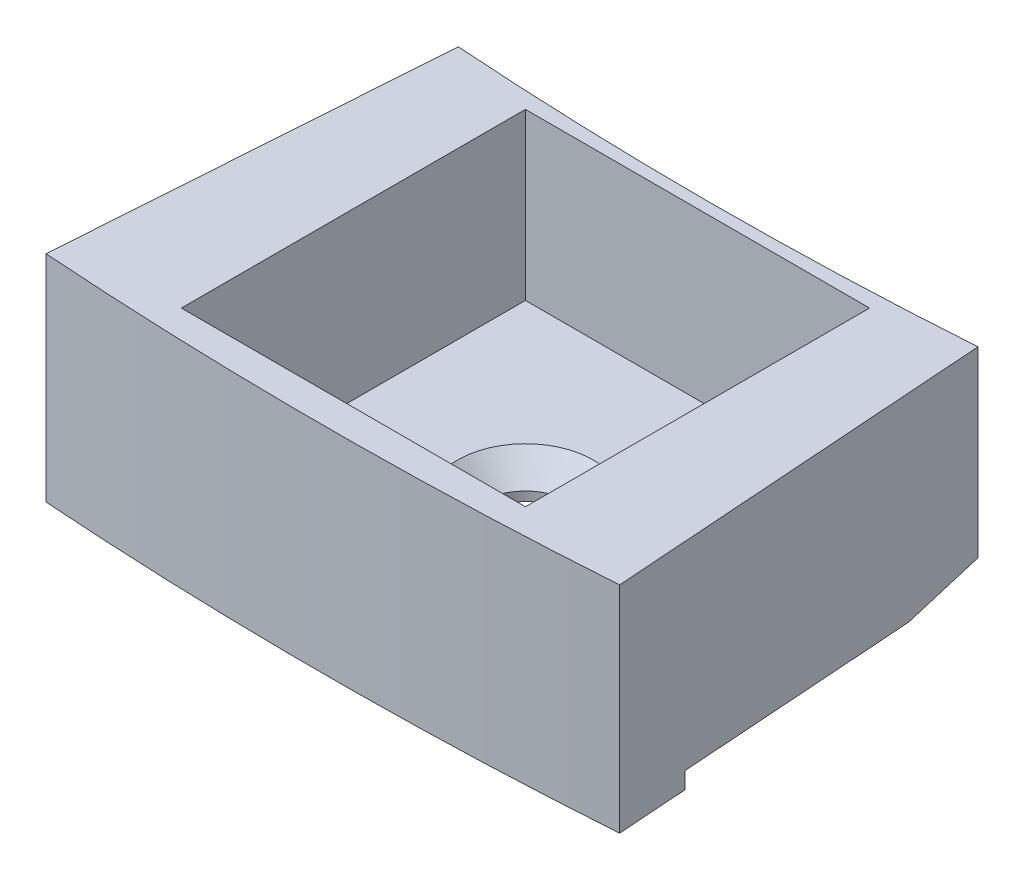
from build123d import *

# Parameters (mm, degrees)
SKETCH2_R           = 2.65
BOSS_EXTRUDE1_DEPTH = 2
BOSS_EXTRUDE2_DEPTH = 2
CHAMFER1_SIZE       = 4.5
CHAMFER1_SIZE2      = 0.956504528
BOSS_EXTRUDE3_START = 1
BOSS_EXTRUDE3_DEPTH = 1
SKETCH21_W          = 20.8
SKETCH21_H          = 20.8
BOSS_EXTRUDE4_DEPTH = 10


with BuildPart() as part:
    # Sketch2 → Boss-Extrude1 (new body)
    with BuildSketch(Plane(origin=(0, 0, 0), x_dir=(1, 0, 0), z_dir=(0, 1, 0))):
        with BuildLine():
            Line((-15.984695958, -228.591802117), (-17.334483725, -247.89466649))
            ThreePointArc((-17.334483725, -247.89466649), (0, -248.5), (17.334483725, -247.89466649))
            Line((17.334483725, -247.89466649), (15.984695958, -228.591802117))
            ThreePointArc((15.984695958, -228.591802117), (0, -229.15), (-15.984695958, -228.591802117))
        make_face()
        with Locations(Location((0, -236.25, 0), (0, 0, 270))):
            Circle(SKETCH2_R, mode=Mode.SUBTRACT)
    extrude(amount=BOSS_EXTRUDE1_DEPTH)

    # Sketch3 → Boss-Extrude2 (add)
    with BuildSketch(Plane(origin=(0, 0, 0), x_dir=(1, 0, 0), z_dir=(0, 1, 0))):
        with BuildLine():
            Line((-15.705670063, -224.601545916), (-15.984695958, -228.591802117))
            ThreePointArc((-15.984695958, -228.591802117), (0, -229.15), (15.984695958, -228.591802117))
            Line((15.984695958, -228.591802117), (15.705670063, -224.601545916))
            ThreePointArc((15.705670063, -224.601545916), (0, -225.15), (-15.705670063, -224.601545916))
        make_face()
    extrude(amount=BOSS_EXTRUDE2_DEPTH)

    # Chamfer1
    chamfer1_edges = [part.edges().sort_by_distance(p)[0] for p in [
        (0, 0, 225.15),
    ]]
    chamfer1_side = [part.faces().sort_by_distance(p)[0] for p in [
        (16.100023839, 0, 236.277479174),
    ]]
    chamfer(chamfer1_edges, length=CHAMFER1_SIZE, length2=CHAMFER1_SIZE2, reference=chamfer1_side[0])

    # Sketch4 → Boss-Extrude3 (add)
    with BuildSketch(Plane.XZ.offset(BOSS_EXTRUDE3_START)):
        with BuildLine():
            Line((-17.334483725, 247.89466649), (-17.038018712, 243.655019276))
            ThreePointArc((-17.038018712, 243.655019276), (0, 244.25), (17.038018712, 243.655019276))
            Line((17.038018712, 243.655019276), (17.334483725, 247.89466649))
            ThreePointArc((17.334483725, 247.89466649), (0, 248.5), (-17.334483725, 247.89466649))
        make_face()
    extrude(amount=-BOSS_EXTRUDE3_DEPTH)

    # Sketch20 → CSK for M3.5 Flat Head Machine Screw2 (revolve, cut)
    with BuildSketch(Plane(origin=(0, 2, 236.25), x_dir=(0, 0, 1), z_dir=(1, 0, 0))):
        Polygon((0, 0), (0, 3), (1.85, 3), (1.85, 2.25), (4.1, 0), align=None)
    revolve(axis=Axis((0, 8.35, 236.25), (0, -1, 0)), mode=Mode.SUBTRACT)

    # Sketch21 → Boss-Extrude4 (add)
    with BuildSketch(Plane(origin=(0, 2, 0), x_dir=(1, 0, 0), z_dir=(0, 1, 0))):
        with BuildLine():
            Line((17.334483725, -247.89466649), (15.705670063, -224.601545916))
            ThreePointArc((15.705670063, -224.601545916), (0, -225.15), (-15.705670063, -224.601545916))
            Line((-15.705670063, -224.601545916), (-17.334483725, -247.89466649))
            ThreePointArc((-17.334483725, -247.89466649), (0, -248.5), (17.334483725, -247.89466649))
        make_face()
        with Locations((0, -236.25)):
            Rectangle(SKETCH21_W, SKETCH21_H, mode=Mode.SUBTRACT)
    extrude(amount=BOSS_EXTRUDE4_DEPTH)


solid = part.part
